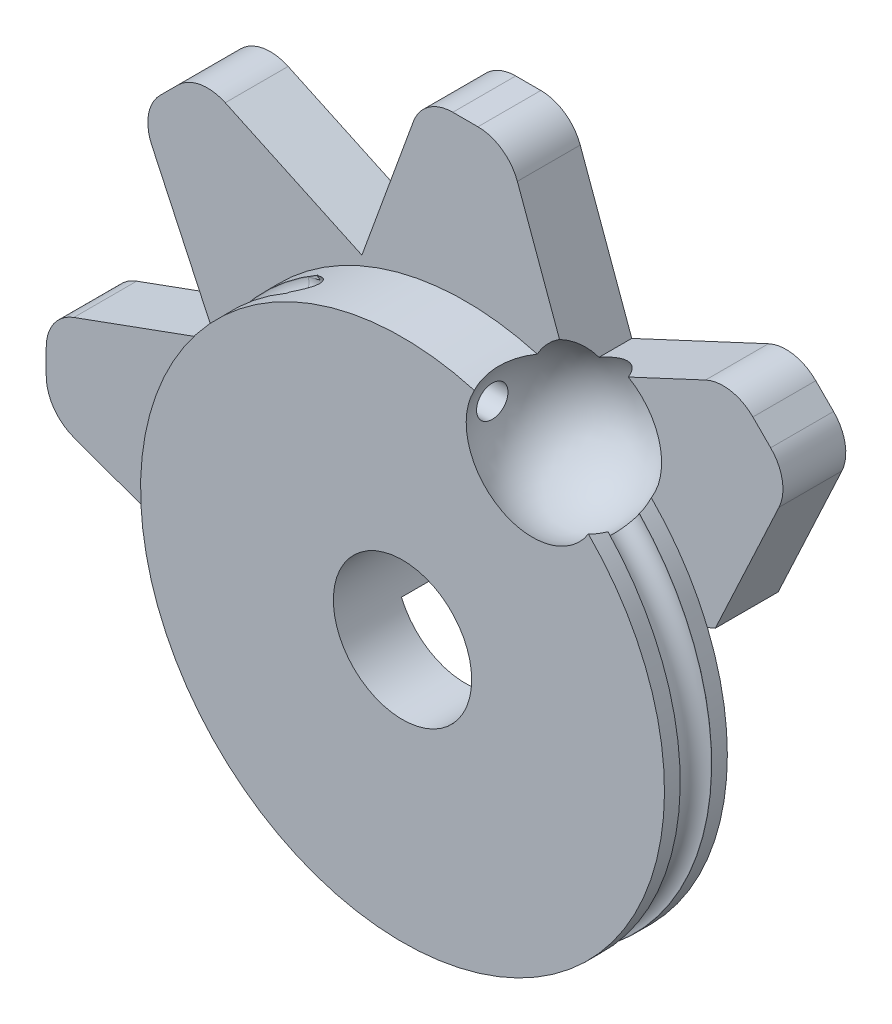
from build123d import *

# Parameters (mm, degrees)
SKETCH1_R                          = 6.25
BODY_DEPTH                         = 1.5
HOLE_TO_TRAP_CABLE_KNOT_DEPTH      = 10
HOLE_TO_TRAP_CABLE_KNOT_DEPTH_BACK = 9.965210539
SKETCH2_R                          = 0.375
THUMB_GRIP_DEPTH                   = 1.5
SKETCH13_R                         = 1.65
HOLE_FOR_SCREW_DEPTH               = 15.456832295


with BuildPart() as part:
    # Sketch1 → body (new body)
    with BuildSketch(Plane.XY):
        Circle(SKETCH1_R)
    extrude(amount=BODY_DEPTH)

    # Sketch2 → Hole to trap cable knot (cut, two sides: drawn at the far end of the back side and taken through both)
    with BuildSketch(Plane(origin=(0, 0, 0), x_dir=(0, 0, -1), z_dir=(1, 0, 0)).offset(-HOLE_TO_TRAP_CABLE_KNOT_DEPTH_BACK)):
        with Locations(Location((-0.75, 5.25, 0), (0, 0, 180))):
            Circle(SKETCH2_R)
        with Locations(Location((-0.75, -4.75, 0), (0, 0, 180))):
            Circle(SKETCH2_R)
    extrude(amount=HOLE_TO_TRAP_CABLE_KNOT_DEPTH + HOLE_TO_TRAP_CABLE_KNOT_DEPTH_BACK, mode=Mode.SUBTRACT)

    # track for cable: sweep along a path in Sketch6
    with BuildLine(Plane.XY.offset(1.875)) as track_for_cable_path:
        ThreePointArc((-3.125, 5.412658774), (-0.078980905, -6.249500941), (3.260789939, 5.331955455))
    # Sketch10 → track for cable (sweep, cut)
    with BuildSketch(Plane(origin=(-5.412658774, 9.375, 0), x_dir=(-0.4999999999999889, 0.866025403784445, 0), z_dir=(-0.866025403784445, -0.4999999999999889, 0))):
        with BuildLine():
            Line((-4.583101682, -1.125), (-3.872701536, -1.125))
            Line((-3.872701536, -1.125), (-3.872701536, -0.374795087))
            Line((-3.872701536, -0.374795087), (-4.583101682, -0.374795087))
            ThreePointArc((-4.583101682, -0.374795087), (-4.958204138, -0.749897543), (-4.583101682, -1.125))
        make_face()
    sweep(path=track_for_cable_path.line, mode=Mode.SUBTRACT)

    # Sketch14 → thumb grip (add)
    with BuildSketch(Plane(origin=(0, 0, 0), x_dir=(-1, 0, 0), z_dir=(0, 0, -1))):
        with BuildLine():
            Line((5.729357486, 7.4822541), (2.469632038, 5.96221916))
            Line((2.469632038, 5.96221916), (1.239485083, 9.342020143))
            ThreePointArc((1.239485083, 9.342020143), (0.873368898, 9.819152044), (0.299792462, 10))
            Line((0.299792462, 10), (-0.299792462, 10))
            ThreePointArc((-0.299792462, 10), (-0.873368898, 9.819152044), (-1.239485083, 9.342020143))
            Line((-1.239485083, 9.342020143), (-2.469632038, 5.96221916))
            Line((-2.469632038, 5.96221916), (-5.729357486, 7.4822541))
            ThreePointArc((-5.729357486, 7.4822541), (-6.325623926, 7.560754066), (-6.859082529, 7.283053095))
            Line((-6.859082529, 7.283053095), (-7.283053095, 6.859082529))
            ThreePointArc((-7.283053095, 6.859082529), (-7.560754066, 6.325623926), (-7.4822541, 5.729357486))
            Line((-7.4822541, 5.729357486), (-5.96221916, 2.469632038))
            Line((-5.96221916, 2.469632038), (5.96221916, -2.469632038))
            Line((5.96221916, -2.469632038), (9.342020143, -1.239485083))
            ThreePointArc((9.342020143, -1.239485083), (9.819152044, -0.873368898), (10, -0.299792462))
            Line((10, -0.299792462), (10, 0.299792462))
            ThreePointArc((10, 0.299792462), (9.819152044, 0.873368898), (9.342020143, 1.239485083))
            Line((9.342020143, 1.239485083), (5.96221916, 2.469632038))
            Line((5.96221916, 2.469632038), (7.4822541, 5.729357486))
            ThreePointArc((7.4822541, 5.729357486), (7.560754066, 6.325623926), (7.283053095, 6.859082529))
            Line((7.283053095, 6.859082529), (6.859082529, 7.283053095))
            ThreePointArc((6.859082529, 7.283053095), (6.325623926, 7.560754066), (5.729357486, 7.4822541))
        make_face()
    extrude(amount=THUMB_GRIP_DEPTH)

    # Sketch13 → hole for screw (cut, through all)
    with BuildSketch(Plane.XY.offset(1.5)):
        Circle(SKETCH13_R)
    extrude(amount=-HOLE_FOR_SCREW_DEPTH, mode=Mode.SUBTRACT)

    # Sketch20 → trap for ball (revolve, cut)
    with BuildSketch(Plane(origin=(3.1, 0, 0), x_dir=(0, 0, -1), z_dir=(1, 0, 0))):
        with BuildLine():
            Line((-0.75, 7), (-0.75, 3.5))
            ThreePointArc((-0.75, 3.5), (1, 5.25), (-0.75, 7))
        make_face()
    revolve(axis=Axis((3.1, 7.793428849, 0.75), (0, -1, 0)), mode=Mode.SUBTRACT)


solid = part.part
